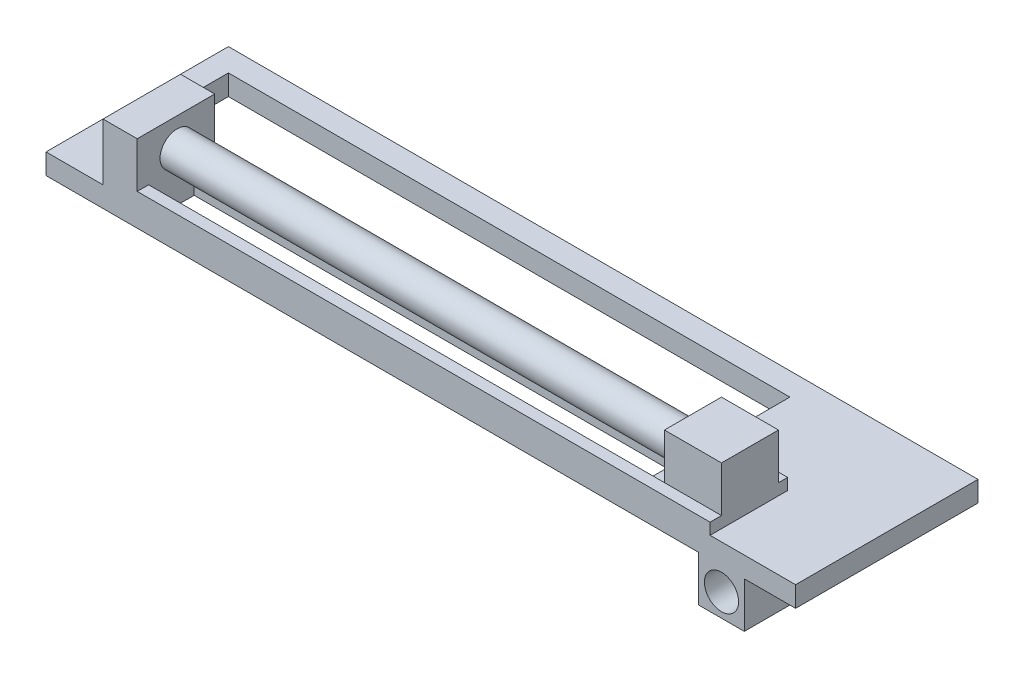
from build123d import *

# Parameters (mm, degrees)
SKETCH_1_W          = 131.5
SKETCH_1_H          = 3.6
EXTRUDE_1_DEPTH     = 4
SKETCH_2_W          = 4
SKETCH_2_H          = 3.6
EXTRUDE_2_DEPTH     = 28
SKETCH_3_W          = 4
SKETCH_3_H          = 3.6
EXTRUDE_3_DEPTH     = 28
SKETCH_4_W          = 4
SKETCH_4_H          = 3.6
EXTRUDE_4_DEPTH     = 123.5
SKETCH_5_W          = 8
SKETCH_5_H          = 32
EXTRUDE_5_DEPTH     = 8
CUT_EXTRUDE_1_REACH = 137.574
SKETCH_6_R          = 3
EXTRUDE_6_REACH     = 136.686
SKETCH_7_W          = 25
SKETCH_7_H          = 3.6
EXTRUDE_7_REACH     = 109.677
SKETCH_8_W          = 3.6
SKETCH_8_H          = 3.6
SKETCH_13_W         = 10
SKETCH_13_H         = 10
EXTRUDE_8_DEPTH     = 10
EXTRUDE_9_REACH     = 136.019
SKETCH_14_W         = 12
SKETCH_14_H         = 3.6
SKETCH_15_W         = 6
SKETCH_15_H         = 13.6
EXTRUDE_10_DEPTH    = 10
EXTRUDE_11_REACH    = 114.032
SKETCH_16_R         = 3
SKETCH_17_W         = 100.5
SKETCH_17_H         = 2
EXTRUDE_12_DEPTH    = 2
SKETCH_18_W         = 100.5
SKETCH_18_H         = 1.6
EXTRUDE_13_DEPTH    = 2


with BuildPart() as part:
    # 草图1 → 凸台-拉伸1 (new body)
    with BuildSketch(Plane.XY):
        with Locations((65.75, 1.8)):
            Rectangle(SKETCH_1_W, SKETCH_1_H)
    extrude(amount=-EXTRUDE_1_DEPTH)

    # 草图2 → 凸台-拉伸2 (add)
    with BuildSketch(Plane(origin=(0, 0, -4), x_dir=(-1, 0, 0), z_dir=(0, 0, -1))):
        with Locations((-2, 1.8)):
            Rectangle(SKETCH_2_W, SKETCH_2_H)
    extrude(amount=EXTRUDE_2_DEPTH)

    # 草图3 → 凸台-拉伸3 (add)
    with BuildSketch(Plane(origin=(0, 0, -4), x_dir=(-1, 0, 0), z_dir=(0, 0, -1))):
        with Locations((-129.5, 1.8)):
            Rectangle(SKETCH_3_W, SKETCH_3_H)
    extrude(amount=EXTRUDE_3_DEPTH)

    # 草图4 → 凸台-拉伸4 (add)
    with BuildSketch(Plane(origin=(4, 0, 0), x_dir=(0, 0, -1), z_dir=(1, 0, 0))):
        with Locations((30, 1.8)):
            Rectangle(SKETCH_4_W, SKETCH_4_H)
    extrude(amount=EXTRUDE_4_DEPTH)

    # 草图5 → 凸台-拉伸5 (add)
    with BuildSketch(Plane.XZ):
        with Locations((118.5, -16)):
            Rectangle(SKETCH_5_W, SKETCH_5_H)
    extrude(amount=EXTRUDE_5_DEPTH)

    # 草图6 → 切除-拉伸1 (cut, up to next)
    with BuildSketch(Plane.XY, mode=Mode.PRIVATE) as cut_extrude_1_sk1:
        with Locations((118.5, -4)):
            Circle(SKETCH_6_R)
    cut_extrude_1_tool1 = extrude(cut_extrude_1_sk1.sketch, amount=-CUT_EXTRUDE_1_REACH, mode=Mode.PRIVATE) & part.part
    add(cut_extrude_1_tool1.solids().sort_by_distance((118.5, -4, 0))[0], mode=Mode.SUBTRACT)

    # 草图7 → 凸台-拉伸6 (add, up to next)
    with BuildSketch(Plane(origin=(0, 0, -4), x_dir=(-1, 0, 0), z_dir=(0, 0, -1)), mode=Mode.PRIVATE) as extrude_6_sk1:
        with Locations((-115, 1.8)):
            Rectangle(SKETCH_7_W, SKETCH_7_H)
    extrude_6_tool1 = extrude(extrude_6_sk1.sketch, amount=EXTRUDE_6_REACH, mode=Mode.PRIVATE) - part.part
    add(extrude_6_tool1.solids().sort_by_distance((115, 1.8, -4))[0])

    # 草图8 → 凸台-拉伸7 (add, up to next)
    with BuildSketch(Plane.ZY.offset(-102.5), mode=Mode.PRIVATE) as extrude_7_sk1:
        with Locations((-11.8, 1.8)):
            Rectangle(SKETCH_8_W, SKETCH_8_H)
    extrude_7_tool1 = extrude(extrude_7_sk1.sketch, amount=EXTRUDE_7_REACH, mode=Mode.PRIVATE) - part.part
    add(extrude_7_tool1.solids().sort_by_distance((102.5, 1.8, -11.8))[0])

    # 草图13 → 凸台-拉伸8 (add)
    with BuildSketch(Plane(origin=(0, 3.6, 0), x_dir=(1, 0, 0), z_dir=(0, 1, 0))):
        with Locations((111.5, 7)):
            Rectangle(SKETCH_13_W, SKETCH_13_H)
    extrude(amount=EXTRUDE_8_DEPTH)

    # 草图14 → 凸台-拉伸9 (add, up to next)
    with BuildSketch(Plane.XY.offset(-10), mode=Mode.PRIVATE) as extrude_9_sk1:
        with Locations((10, 1.8)):
            Rectangle(SKETCH_14_W, SKETCH_14_H)
    extrude_9_tool1 = extrude(extrude_9_sk1.sketch, amount=EXTRUDE_9_REACH, mode=Mode.PRIVATE) - part.part
    add(extrude_9_tool1.solids().sort_by_distance((10, 1.8, -10))[0])

    # 草图15 → 凸台-拉伸10 (add)
    with BuildSketch(Plane(origin=(0, 3.6, 0), x_dir=(1, 0, 0), z_dir=(0, 1, 0))):
        with Locations((13, 6.8)):
            Rectangle(SKETCH_15_W, SKETCH_15_H)
    extrude(amount=EXTRUDE_10_DEPTH)

    # 草图16 → 凸台-拉伸11 (add, up to next)
    with BuildSketch(Plane.ZY.offset(-106.5), mode=Mode.PRIVATE) as extrude_11_sk1:
        with Locations(Location((-7, 8.6, 0), (0, 0, 180))):
            Circle(SKETCH_16_R)
    extrude_11_tool1 = extrude(extrude_11_sk1.sketch, amount=EXTRUDE_11_REACH, mode=Mode.PRIVATE) - part.part
    add(extrude_11_tool1.solids().sort_by_distance((106.5, 8.6, -7))[0])

    # 草图17 → 凸台-拉伸12 (add)
    with BuildSketch(Plane(origin=(0, 3.6, 0), x_dir=(1, 0, 0), z_dir=(0, 1, 0))):
        with Locations((66.25, 1)):
            Rectangle(SKETCH_17_W, SKETCH_17_H)
    extrude(amount=EXTRUDE_12_DEPTH)

    # 草图18 → 凸台-拉伸13 (add)
    with BuildSketch(Plane(origin=(0, 3.6, 0), x_dir=(1, 0, 0), z_dir=(0, 1, 0))):
        with Locations((66.25, 12.8)):
            Rectangle(SKETCH_18_W, SKETCH_18_H)
    extrude(amount=EXTRUDE_13_DEPTH)


solid = part.part
